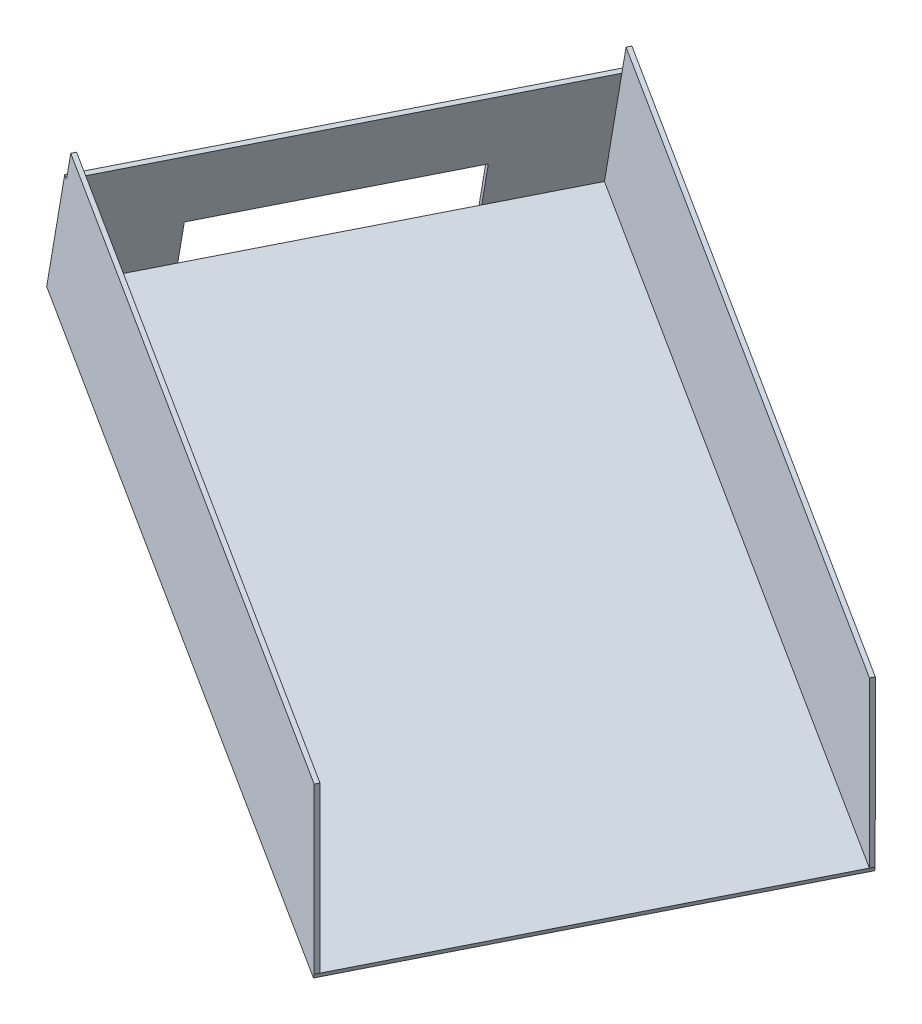
from build123d import *

# Parameters (mm, degrees)
BOSS_EXTRUDE1_DEPTH = 609.6
CUT_EXTRUDE1_DEPTH  = 596.9
CUT_EXTRUDE2_START  = -6.35
CUT_EXTRUDE2_DEPTH  = 6.35


with BuildPart() as part:
    # Sketch1 → Boss-Extrude1 (new body)
    with BuildSketch(Plane(origin=(2274.798526179, 0, -4526.609622936), x_dir=(0.8935178411679832, 0, 0.44902769125579206), z_dir=(-0.44902769125579206, 0, 0.8935178411679832))):
        Polygon((-4499.407931927, 647.178189885), (-4499.091966051, 887.542246672), (-5297.754801193, 1148.204732428), (-5311.546165746, 1105.948362922), (-5317.582789961, 1107.918557858), (-5376.688638045, 926.819831407), (-4501.378126863, 641.14156567), align=None)
    extrude(amount=-BOSS_EXTRUDE1_DEPTH)

    # Sketch2 → Cut-Extrude1 (cut)
    with BuildSketch(Plane(origin=(2277.649852018, 0, -4532.283461227), x_dir=(-0.8935178411679832, 0, -0.44902769125579206), z_dir=(0.44902769125579206, 0, -0.8935178411679832))):
        Polygon((5297.754801193, 1148.204732428), (4977.813717796, 1043.784400813), (4499.091966051, 887.542246672), (4499.407931927, 647.178189885), (5368.681818894, 930.886260686), align=None)
    extrude(amount=CUT_EXTRUDE1_DEPTH, mode=Mode.SUBTRACT)

    # Sketch3 → Cut-Extrude2 (cut)
    with BuildSketch(Plane(origin=(-4585.952542808, 1675.102491314, -2304.620666347), x_dir=(-0.40095713367550895, 0.14645687831706847, 0.9043139718860588), z_dir=(-0.8494222734757242, 0.31026691907399934, -0.4268679424033393)).offset(CUT_EXTRUDE2_START)):
        Polygon((-5579.388539548, 150.427587067), (-5591.127897041, 75.137298944), (-5264.869981841, 24.266749807), (-5253.130624348, 99.55703793), align=None)
    extrude(amount=CUT_EXTRUDE2_DEPTH, mode=Mode.SUBTRACT)


solid = part.part
